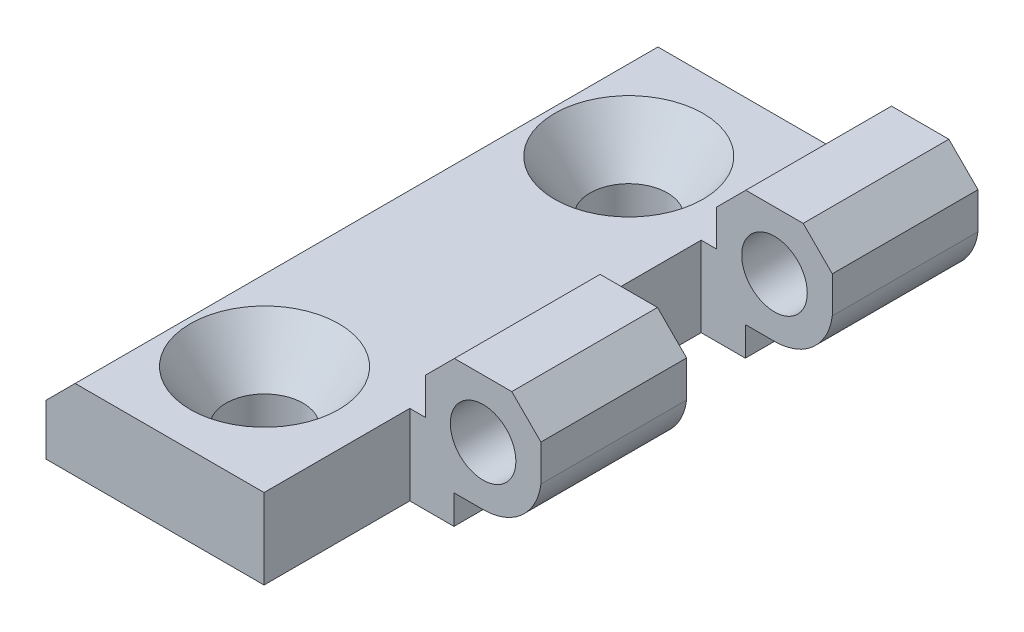
from build123d import *

# Parameters (mm, degrees)
SKETCH_1_W                   = 20
SKETCH_1_H                   = 40
EXTRUDE_1_DEPTH              = 5.5
SKETCH_2_W                   = 2
SKETCH_2_H                   = 2
CUT_EXTRUDE_1_DEPTH          = 46.058295574
SKETCH_3_R                   = 2.25
EXTRUDE_2_DEPTH              = 40
SKETCH_3_2_R                 = 2.25
CUT_EXTRUDE_2_DEPTH          = 46.82575695
CHAMFER_1_SIZE               = 2
SKETCH_4_W                   = 9
SKETCH_4_H                   = 10
CUT_EXTRUDE_3_DEPTH          = 31
HOLE_WIZARD_M5_3_D           = 5.3
HOLE_WIZARD_M5_3_DEPTH       = 6
HOLE_WIZARD_M5_3_CSINK_D     = 10.2
HOLE_WIZARD_M5_3_CSINK_ANGLE = 70
HOLE_WIZARD_M5_3_TIP         = 1.59228064


with BuildPart() as part:
    # 草图1 → 凸台-拉伸1 (new body)
    with BuildSketch(Plane(origin=(0, 0, 0), x_dir=(1, 0, 0), z_dir=(0, 1, 0))):
        with Locations((-10, 0)):
            Rectangle(SKETCH_1_W, SKETCH_1_H)
    extrude(amount=EXTRUDE_1_DEPTH)

    # 草图2 → 切除-拉伸1 (cut, through all)
    with BuildSketch(Plane.XY.offset(20)):
        with Locations((-1, 1)):
            Rectangle(SKETCH_2_W, SKETCH_2_H)
    extrude(amount=-CUT_EXTRUDE_1_DEPTH, mode=Mode.SUBTRACT)

    # 草图3 → 凸台-拉伸2 (add)
    with BuildSketch(Plane.XY.offset(20)):
        with BuildLine():
            Line((-1.968626967, 10), (1.968626967, 10))
            Line((1.968626967, 10), (3.968626967, 8))
            Line((3.968626967, 8), (3.968626967, 5.5))
            ThreePointArc((3.968626967, 5.5), (0, 2), (-3.968626967, 5.5))
            Line((-3.968626967, 5.5), (-3.968626967, 8))
            Line((-3.968626967, 8), (-1.968626967, 10))
        make_face()
        with Locations((0, 6)):
            Circle(SKETCH_3_R, mode=Mode.SUBTRACT)
    extrude(amount=-EXTRUDE_2_DEPTH)

    # 草图3<2> → 切除-拉伸2 (cut, through all)
    with BuildSketch(Plane.XY.offset(20)):
        with Locations((0, 6)):
            Circle(SKETCH_3_2_R)
    extrude(amount=-CUT_EXTRUDE_2_DEPTH, mode=Mode.SUBTRACT)

    # 倒角1
    chamfer_1_edges = [part.edges().sort_by_distance(p)[0] for p in [
        (-20, 5.5, 0),
    ]]
    chamfer(chamfer_1_edges, length=CHAMFER_1_SIZE)

    # 草图4 → 切除-拉伸3 (cut, through all)
    with BuildSketch(Plane(origin=(0, 0, 0), x_dir=(1, 0, 0), z_dir=(0, 1, 0))):
        with Locations((-0.531373033, 5)):
            Rectangle(SKETCH_4_W, SKETCH_4_H)
        with Locations((-0.531373033, -15)):
            Rectangle(SKETCH_4_W, SKETCH_4_H)
    extrude(amount=CUT_EXTRUDE_3_DEPTH, mode=Mode.SUBTRACT)

    # M5 十字切槽平头螺钉锥孔槽口3
    with Locations(Plane(origin=(0, 5.5, 0), x_dir=(1, 0, 0), z_dir=(0, 1, 0))):
        with Locations((-12.5, 12.5), (-12.5, -12.5)):
            CounterSinkHole(HOLE_WIZARD_M5_3_D / 2, HOLE_WIZARD_M5_3_CSINK_D / 2, depth=HOLE_WIZARD_M5_3_DEPTH, counter_sink_angle=HOLE_WIZARD_M5_3_CSINK_ANGLE)
            with Locations((0, 0, -(HOLE_WIZARD_M5_3_DEPTH + HOLE_WIZARD_M5_3_TIP / 2))):  # 118° drill point
                Cone(0, HOLE_WIZARD_M5_3_D / 2, HOLE_WIZARD_M5_3_TIP, mode=Mode.SUBTRACT)


solid = part.part
